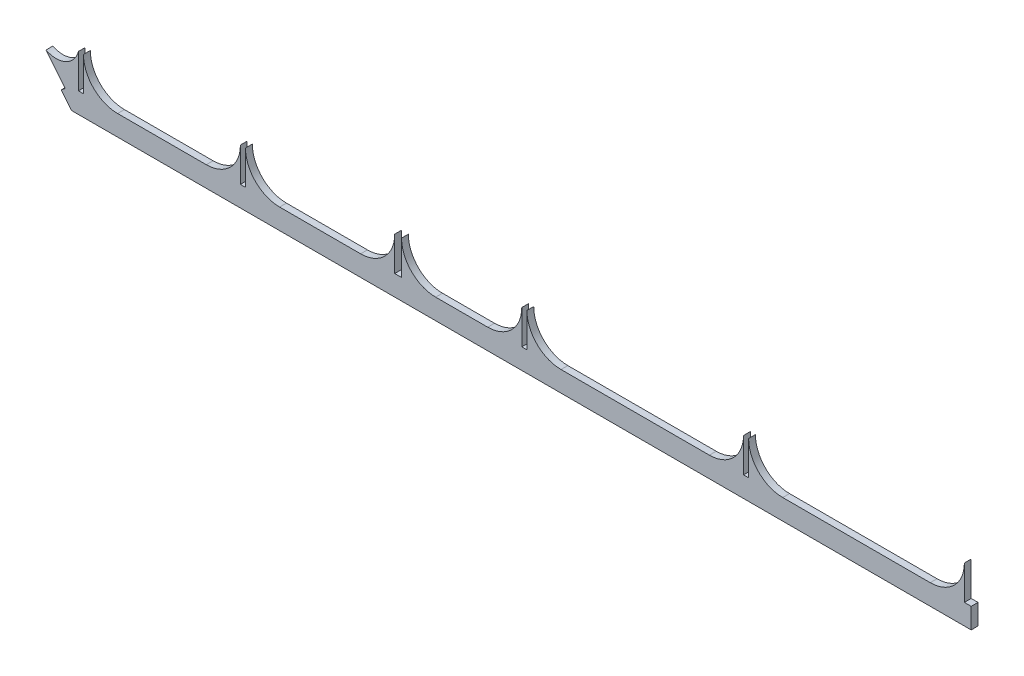
from build123d import *

# Parameters (mm, degrees)
EXTRUDE_1_DEPTH = 2


with BuildPart() as part:
    # Model → 凸台-拉伸1 (new body)
    with BuildSketch(Plane.XY):
        with BuildLine():
            Line((287.664550766, 8.035001988), (23.914550766, 8.035001988))
            Line((23.914550766, 8.035001988), (20.879974458, 11.754816811))
            Line((20.879974458, 11.754816811), (22.08435013, 12.730101001))
            Line((22.08435013, 12.730101001), (16.425816067, 19.66638978))
            ThreePointArc((16.425816067, 19.66638978), (22.207201951, 19.598265756), (25.914550766, 24.035001988))
            Line((25.914550766, 24.035001988), (25.914550766, 14.035001988))
            Line((25.914550766, 14.035001988), (27.414546887, 14.035001988))
            Line((27.414546887, 14.035001988), (27.414546887, 24.035001988))
            ThreePointArc((27.414546887, 24.035001988), (30.343479076, 16.963934176), (37.414546887, 14.035001988))
            Line((37.414546887, 14.035001988), (63.414550766, 14.035001988))
            ThreePointArc((63.414550766, 14.035001988), (70.485618578, 16.963934176), (73.414550766, 24.035001988))
            Line((73.414550766, 24.035001988), (73.414550766, 14.035001988))
            Line((73.414550766, 14.035001988), (74.914546887, 14.035001988))
            Line((74.914546887, 14.035001988), (74.914546887, 24.035001988))
            ThreePointArc((74.914546887, 24.035001988), (77.843479076, 16.963934176), (84.914546887, 14.035001988))
            Line((84.914546887, 14.035001988), (108.664550766, 14.035001988))
            ThreePointArc((108.664550766, 14.035001988), (115.735618578, 16.963934176), (118.664550766, 24.035001988))
            Line((118.664550766, 24.035001988), (118.664550766, 14.035001988))
            Line((118.664550766, 14.035001988), (120.664546887, 14.035001988))
            Line((120.664546887, 14.035001988), (120.664546887, 24.035001988))
            ThreePointArc((120.664546887, 24.035001988), (123.593479076, 16.963934176), (130.664546887, 14.035001988))
            Line((130.664546887, 14.035001988), (145.914550766, 14.035001988))
            ThreePointArc((145.914550766, 14.035001988), (152.985618578, 16.963934176), (155.914550766, 24.035001988))
            Line((155.914550766, 24.035001988), (155.914550766, 14.035001988))
            Line((155.914550766, 14.035001988), (157.414546887, 14.035001988))
            Line((157.414546887, 14.035001988), (157.414546887, 24.035001988))
            ThreePointArc((157.414546887, 24.035001988), (160.343479076, 16.963934176), (167.414546887, 14.035001988))
            Line((167.414546887, 14.035001988), (210.914550766, 14.035001988))
            ThreePointArc((210.914550766, 14.035001988), (217.985618578, 16.963934176), (220.914550766, 24.035001988))
            Line((220.914550766, 24.035001988), (220.914550766, 14.035001988))
            Line((220.914550766, 14.035001988), (222.414550766, 14.035001988))
            Line((222.414550766, 14.035001988), (222.414550766, 24.035001988))
            ThreePointArc((222.414550766, 24.035001988), (225.343482954, 16.963934176), (232.414550766, 14.035001988))
            Line((232.414550766, 14.035001988), (275.664550766, 14.035001988))
            ThreePointArc((275.664550766, 14.035001988), (282.735618578, 16.963934176), (285.664550766, 24.035001988))
            Line((285.664550766, 24.035001988), (285.664550766, 14.035001988))
            Line((285.664550766, 14.035001988), (287.664550766, 14.035001988))
            Line((287.664550766, 14.035001988), (287.664550766, 8.035001988))
        make_face()
    extrude(amount=EXTRUDE_1_DEPTH)


solid = part.part
